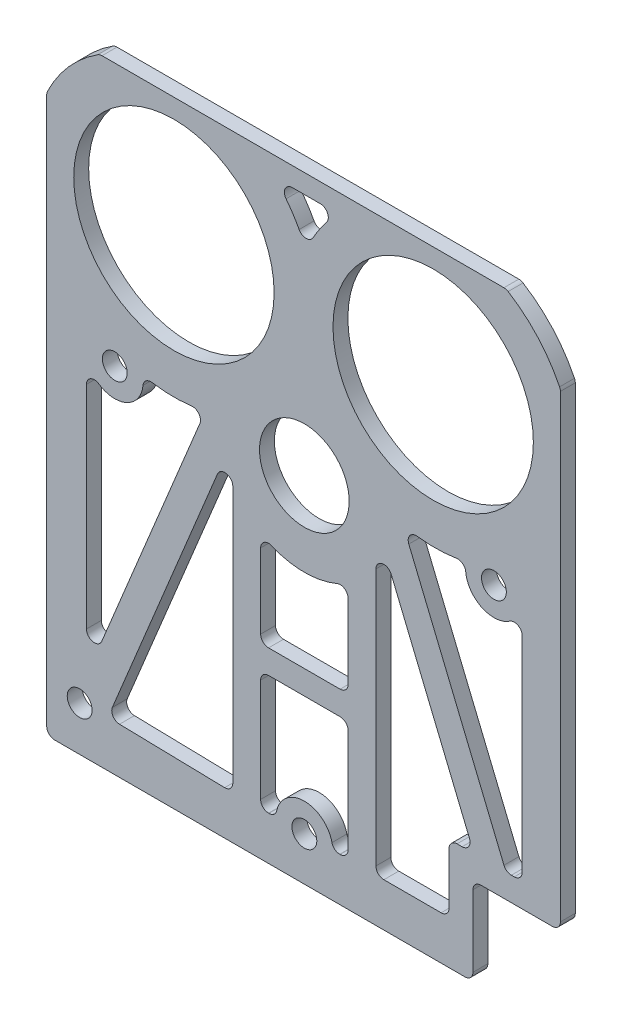
from build123d import *

# Parameters (mm, degrees)
SKETCH2_R           = 32.004
SKETCH2_R_2         = 14.326331359
SKETCH2_R_3         = 3.96875
BOSS_EXTRUDE3_DEPTH = 4.7625
FILLET2_R           = 2.54
FILLET3_R           = 2.54
FILLET4_R           = 2.54
FILLET5_R           = 2.54
SKETCH3_W           = 27.93619
SKETCH3_H           = 27.930200018
CUT_EXTRUDE1_DEPTH  = 4.7625
FILLET6_R           = 2.54
FILLET7_R           = 2.54


with BuildPart() as part:
    # Sketch2 → Boss-Extrude3 (new body)
    with BuildSketch(Plane.XY):
        with BuildLine():
            Line((-161.665509466, 75.768206346), (-31.830687389, 75.768206346))
            ThreePointArc((-31.830687389, 75.768206346), (-21.757108739, 67.512054819), (-14.51238939, 56.688235417))
            Line((-14.51238939, 56.688235417), (-14.51238939, -121.111764583))
            Line((-14.51238939, -121.111764583), (-178.60400939, -121.111764583))
            Line((-178.60400939, -121.111764583), (-178.60400939, 56.688235417))
            ThreePointArc((-178.60400939, 56.688235417), (-171.519463205, 67.457510218), (-161.665509466, 75.768206346))
        make_face()
        with Locations(Location((-137.96400939, 37.668206346, 0), (0, 0, 180))):
            Circle(SKETCH2_R, mode=Mode.SUBTRACT)
        with Locations(Location((-55.15238939, 37.668206346, 0), (0, 0, 180))):
            Circle(SKETCH2_R, mode=Mode.SUBTRACT)
        with Locations(Location((-96.30038939, -8.051793654, 0), (0, 0, 180))):
            Circle(SKETCH2_R_2, mode=Mode.SUBTRACT)
        with Locations(Location((-35.74551939, -8.051793654, 0), (0, 0, 180))):
            Circle(SKETCH2_R_3, mode=Mode.SUBTRACT)
        with Locations(Location((-156.85525939, -8.051793654, 0), (0, 0, 180))):
            Circle(SKETCH2_R_3, mode=Mode.SUBTRACT)
        with Locations(Location((-168.077299629, -106.909902872, 0), (0, 0, 180))):
            Circle(SKETCH2_R_3, mode=Mode.SUBTRACT)
        with Locations(Location((-96.30038939, -107.174765002, 0), (0, 0, 180))):
            Circle(SKETCH2_R_3, mode=Mode.SUBTRACT)
        Polygon((-119.16038939, -45.520207297), (-119.16038939, -76.631793654), (-119.16038939, -107.199674954), (-159.049264091, -106.297978958), (-119.16038939, -9.66645302), align=None, mode=Mode.SUBTRACT)
        Polygon((-73.44038939, -45.520207297), (-73.44038939, -76.631793654), (-73.44038939, -107.174765002), (-50.06857939, -107.174765002), (-50.06857939, -85.561564565), (-42.111373674, -85.561564565), (-73.44038939, -9.66645302), align=None, mode=Mode.SUBTRACT)
        with BuildLine():
            Line((-165.90400939, -8.051793654), (-165.90400939, -72.234249773))
            Line((-165.90400939, -72.234249773), (-165.90400939, -98.126015002))
            Line((-165.90400939, -98.126015002), (-127.899360964, -6.059061553))
            ThreePointArc((-127.899360964, -6.059061553), (-137.96400939, -7.202397682), (-148.028657817, -6.059061553))
            ThreePointArc((-148.028657817, -6.059061553), (-155.852721218, -17.044835062), (-165.90400939, -8.051793654))
        make_face(mode=Mode.SUBTRACT)
        with BuildLine():
            Line((-26.69676939, -8.051793654), (-26.69676939, -72.234249773))
            Line((-26.69676939, -72.234249773), (-26.69676939, -85.561564565))
            Line((-26.69676939, -85.561564565), (-31.883294019, -85.561564565))
            Line((-31.883294019, -85.561564565), (-64.701417817, -6.059061553))
            ThreePointArc((-64.701417817, -6.059061553), (-54.63676939, -7.202397682), (-44.572120964, -6.059061553))
            ThreePointArc((-44.572120964, -6.059061553), (-36.748057563, -17.044835062), (-26.69676939, -8.051793654))
        make_face(mode=Mode.SUBTRACT)
        with BuildLine():
            Line((-110.27038939, -107.174765002), (-105.34913939, -107.174765002))
            ThreePointArc((-105.34913939, -107.174765002), (-96.30038939, -98.126015002), (-87.25163939, -107.174765002))
            Line((-87.25163939, -107.174765002), (-82.33038939, -107.174765002))
            Line((-82.33038939, -107.174765002), (-82.33038939, -69.074765002))
            Line((-82.33038939, -69.074765002), (-110.27038939, -69.074765002))
            Line((-110.27038939, -69.074765002), (-110.27038939, -107.174765002))
        make_face(mode=Mode.SUBTRACT)
        with BuildLine():
            Line((-105.751769429, 69.672206346), (-85.417792119, 69.672206346))
            ThreePointArc((-85.417792119, 69.672206346), (-91.388421836, 62.588949087), (-95.759407575, 54.420997306))
            ThreePointArc((-95.759407575, 54.420997306), (-99.982218631, 62.553302087), (-105.751769429, 69.672206346))
        make_face(mode=Mode.SUBTRACT)
        with BuildLine():
            Line((-110.27038939, -30.911793654), (-110.27038939, -61.454765002))
            Line((-110.27038939, -61.454765002), (-82.33038939, -61.454765002))
            Line((-82.33038939, -61.454765002), (-82.33038939, -30.911793654))
            ThreePointArc((-82.33038939, -30.911793654), (-96.30038939, -34.842473003), (-110.27038939, -30.911793654))
        make_face(mode=Mode.SUBTRACT)
    extrude(amount=BOSS_EXTRUDE3_DEPTH)

    # Fillet2
    fillet2_edges = [part.edges().sort_by_distance(p)[0] for p in [
        (-82.33038939, -30.911793654, 2.38125),
        (-110.27038939, -30.911793654, 2.38125),
        (-148.028657817, -6.059061553, 2.38125),
        (-165.90400939, -8.051793654, 2.38125),
        (-26.69676939, -8.051793654, 2.38125),
        (-44.572120964, -6.059061553, 2.38125),
    ]]
    fillet(fillet2_edges, radius=FILLET2_R)

    # Fillet3
    fillet3_edges = [part.edges().sort_by_distance(p)[0] for p in [
        (-110.27038939, -61.454765002, 2.38125),
        (-82.33038939, -61.454765002, 2.38125),
        (-110.27038939, -107.174765002, 2.38125),
        (-105.34913939, -107.174765002, 2.38125),
        (-87.25163939, -107.174765002, 2.38125),
        (-82.33038939, -107.174765002, 2.38125),
        (-73.44038939, -107.174765002, 2.38125),
        (-50.06857939, -107.174765002, 2.38125),
        (-119.16038939, -107.199674954, 2.38125),
        (-26.69676939, -85.561564565, 2.38125),
    ]]
    fillet(fillet3_edges, radius=FILLET3_R)

    # Fillet4
    fillet4_edges = [part.edges().sort_by_distance(p)[0] for p in [
        (-82.33038939, -69.074765002, 2.38125),
        (-110.27038939, -69.074765002, 2.38125),
    ]]
    fillet(fillet4_edges, radius=FILLET4_R)

    # Fillet5
    fillet5_edges = [part.edges().sort_by_distance(p)[0] for p in [
        (-95.759407575, 54.420997306, 2.38125),
        (-85.417792119, 69.672206346, 2.38125),
        (-105.751769429, 69.672206346, 2.38125),
    ]]
    fillet(fillet5_edges, radius=FILLET5_R)

    # Sketch3 → Cut-Extrude1 (cut)
    with BuildSketch(Plane.XY.offset(4.7625)):
        with Locations((-28.48048439, -107.146664574)):
            Rectangle(SKETCH3_W, SKETCH3_H)
    extrude(amount=-CUT_EXTRUDE1_DEPTH, mode=Mode.SUBTRACT)

    # Fillet6
    fillet6_edges = [part.edges().sort_by_distance(p)[0] for p in [
        (-14.51238939, 56.688235417, 2.38125),
        (-178.60400939, -121.111764583, 2.38125),
        (-178.60400939, 56.688235417, 2.38125),
        (-161.665509466, 75.768206346, 2.38125),
        (-31.830687389, 75.768206346, 2.38125),
        (-14.51238939, -93.181564565, 2.38125),
        (-42.44857939, -121.111764583, 2.38125),
        (-42.44857939, -93.181564565, 2.38125),
    ]]
    fillet(fillet6_edges, radius=FILLET6_R)

    # Fillet7
    fillet7_edges = [part.edges().sort_by_distance(p)[0] for p in [
        (-73.44038939, -9.66645302, 2.38125),
        (-50.06857939, -85.561564565, 2.38125),
        (-42.111373674, -85.561564565, 2.38125),
        (-119.16038939, -9.66645302, 2.38125),
        (-159.049264091, -106.297978958, 2.38125),
        (-165.90400939, -98.126015002, 2.38125),
        (-127.899360964, -6.059061553, 2.38125),
        (-64.701417817, -6.059061553, 2.38125),
        (-31.883294019, -85.561564565, 2.38125),
    ]]
    fillet(fillet7_edges, radius=FILLET7_R)


solid = part.part
